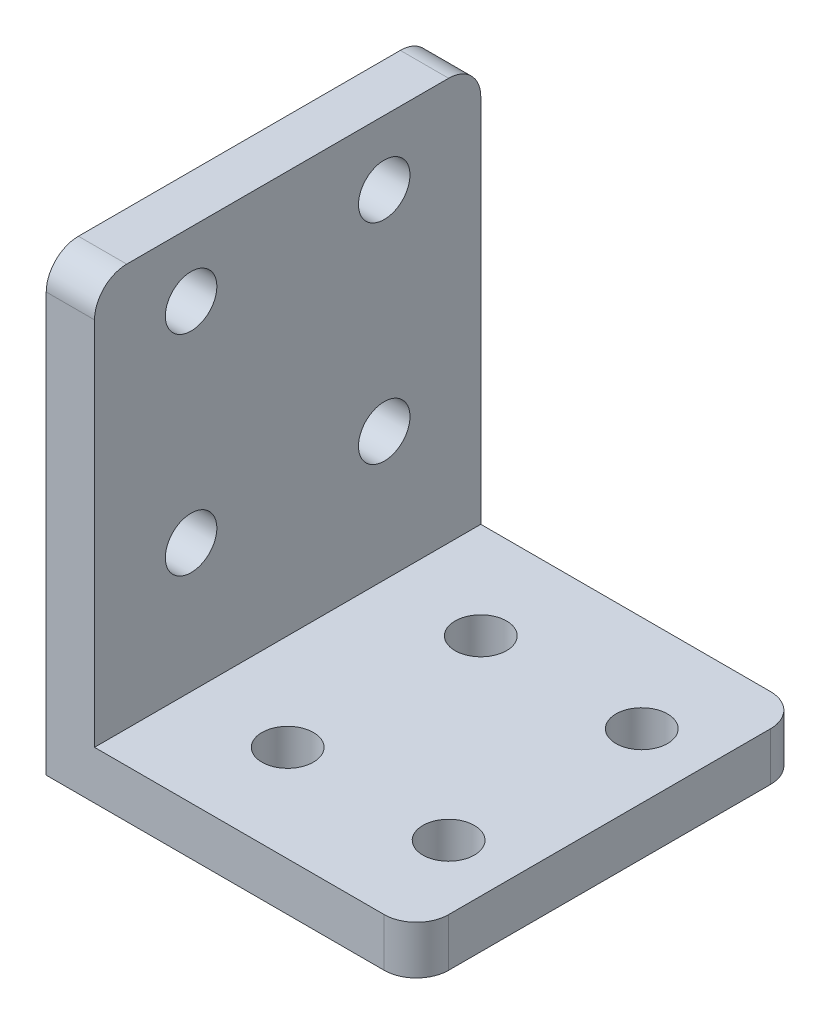
from build123d import *

# Parameters (mm, degrees)
EXTRUDE_1_DEPTH     = 24
SKETCH_2_R          = 1.6
CUT_EXTRUDE_1_DEPTH = 24
SKETCH_3_R          = 1.6
CUT_EXTRUDE_2_DEPTH = 24
FILLET_1_R          = 2
SKETCH_4_R          = 1.6
CUT_EXTRUDE_3_DEPTH = 4
SKETCH_5_R          = 1.6
CUT_EXTRUDE_4_DEPTH = 4


with BuildPart() as part:
    # 草图1 → 凸台-拉伸1 (new body)
    with BuildSketch(Plane.XY):
        Polygon((6, 129.691622655), (3, 129.691622655), (3, 101.691622655), (26, 101.691622655), (26, 104.691622655), (6, 104.691622655), align=None)
    extrude(amount=-EXTRUDE_1_DEPTH)

    # 草图2 → 切除-拉伸1 (cut)
    with BuildSketch(Plane(origin=(6, 0, 0), x_dir=(0, 0, -1), z_dir=(1, 0, 0))):
        with Locations(Location((6, 125.691622655, 0), (0, 0, 90))):
            Circle(SKETCH_2_R)
        with Locations(Location((18, 125.691622655, 0), (0, 0, 90))):
            Circle(SKETCH_2_R)
    extrude(amount=-CUT_EXTRUDE_1_DEPTH, mode=Mode.SUBTRACT)

    # 草图3 → 切除-拉伸2 (cut)
    with BuildSketch(Plane(origin=(0, 104.691622655, 0), x_dir=(1, 0, 0), z_dir=(0, 1, 0))):
        with Locations(Location((22, 6, 0), (0, 0, 180))):
            Circle(SKETCH_3_R)
        with Locations(Location((22, 18, 0), (0, 0, 180))):
            Circle(SKETCH_3_R)
    extrude(amount=-CUT_EXTRUDE_2_DEPTH, mode=Mode.SUBTRACT)

    # 圆角1
    fillet_1_edges = [part.edges().sort_by_distance(p)[0] for p in [
        (4.5, 129.691622655, -24),
        (4.5, 129.691622655, 0),
        (26, 103.191622655, -24),
        (26, 103.191622655, 0),
    ]]
    fillet(fillet_1_edges, radius=FILLET_1_R)

    # 草图4 → 切除-拉伸3 (cut)
    with BuildSketch(Plane.ZY.offset(-3)):
        with Locations(Location((-18, 112.691622655, 0), (0, 0, 270))):
            Circle(SKETCH_4_R)
        with Locations(Location((-6, 112.691622655, 0), (0, 0, 270))):
            Circle(SKETCH_4_R)
    extrude(amount=-CUT_EXTRUDE_3_DEPTH, mode=Mode.SUBTRACT)

    # 草图5 → 切除-拉伸4 (cut)
    with BuildSketch(Plane(origin=(0, 104.691622655, 0), x_dir=(1, 0, 0), z_dir=(0, 1, 0))):
        with Locations(Location((12, 18, 0), (0, 0, 180))):
            Circle(SKETCH_5_R)
        with Locations(Location((12, 6, 0), (0, 0, 180))):
            Circle(SKETCH_5_R)
    extrude(amount=-CUT_EXTRUDE_4_DEPTH, mode=Mode.SUBTRACT)


solid = part.part
